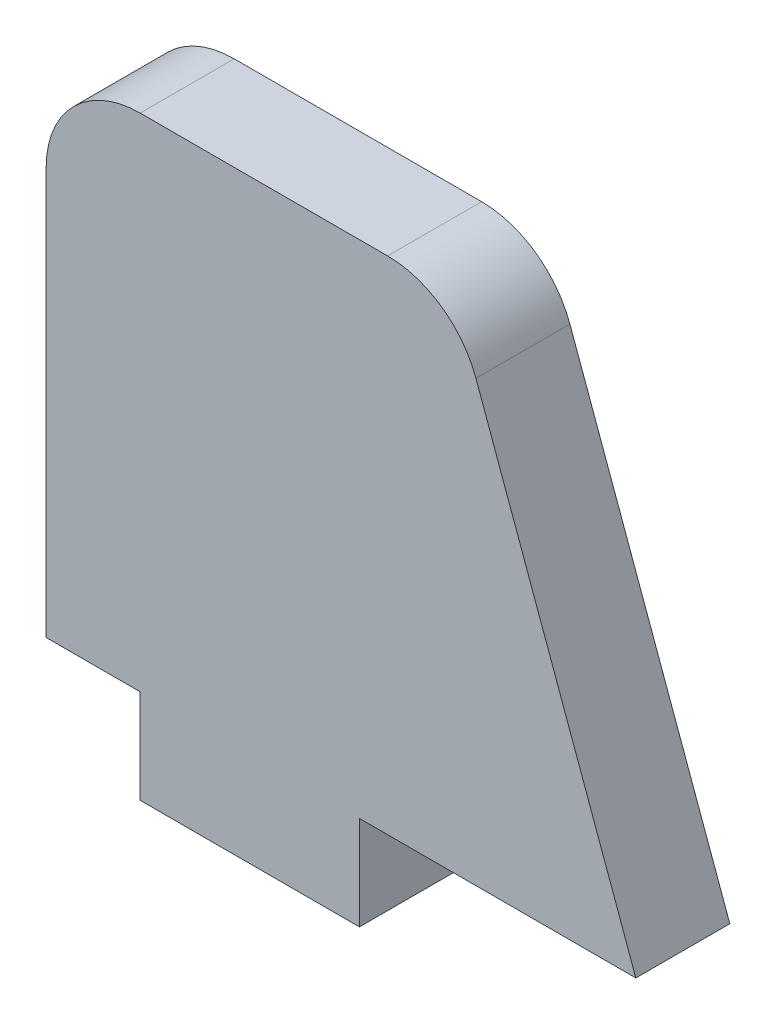
from build123d import *

# Parameters (mm, degrees)
RESSALTO_EXTRUS_O1_DEPTH = 1.5
FILETE1_R                = 3


with BuildPart() as part:
    # Esboço1 → Ressalto-extrusão1 (new, symmetric)
    with BuildSketch(Plane.XY):
        Polygon((-6.5, -8), (-6.5, 8), (6.5, 8), (12.323523748, -8), (3.5, -8), (3.5, -11), (-3.5, -11), (-3.5, -8), align=None)
    extrude(amount=RESSALTO_EXTRUS_O1_DEPTH, both=True)

    # Filete1
    filete1_edges = [part.edges().sort_by_distance(p)[0] for p in [
        (-6.5, 8, 0),
        (6.5, 8, 0),
    ]]
    fillet(filete1_edges, radius=FILETE1_R)


solid = part.part
